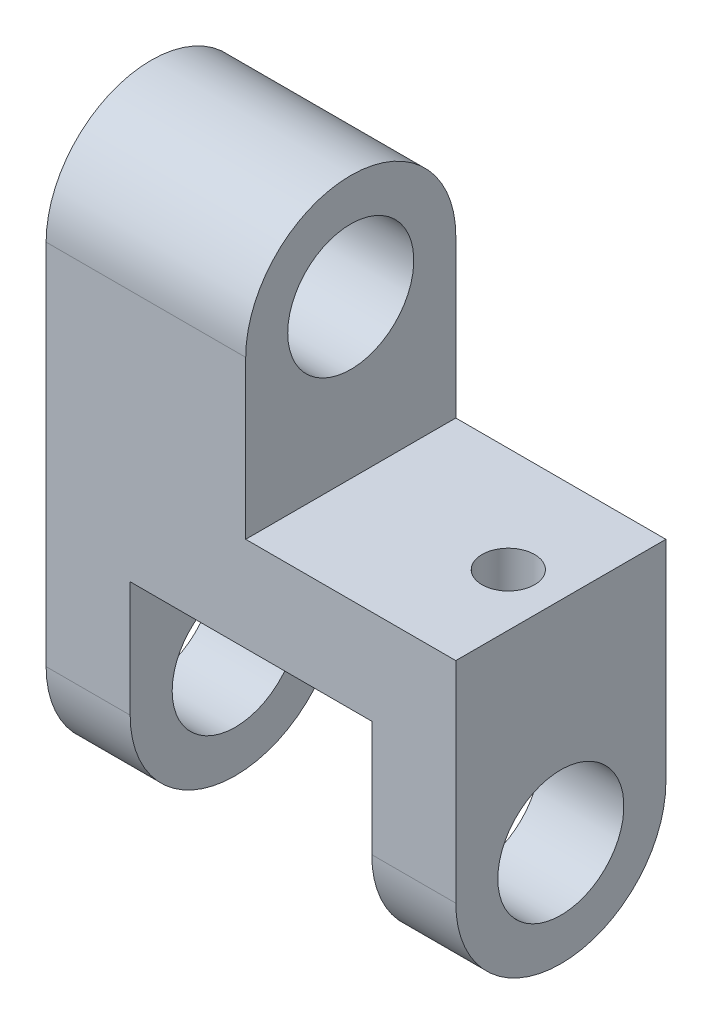
from build123d import *

# Parameters (mm, degrees)
SKETCH_1_R               = 6
EXTRUDE_1_DEPTH          = 39
CUT_EXTRUDE_1_DEPTH      = 49.757050772
CUT_EXTRUDE_1_DEPTH_BACK = 49.757050772
SKETCH_2_W               = 23
SKETCH_2_H               = 34.092407746
CUT_EXTRUDE_2_DEPTH      = 49.757050772
CUT_EXTRUDE_2_DEPTH_BACK = 49.757050772
SKETCH_3_W               = 43.713213687
SKETCH_3_H               = 32.597275916
SKETCH_4_R               = 2.5
CUT_EXTRUDE_3_DEPTH      = 12


with BuildPart() as part:
    # Эскиз1 → Бобышка-Вытянуть1 (new body)
    with BuildSketch(Plane(origin=(0, 0, 0), x_dir=(0, 0, -1), z_dir=(1, 0, 0))):
        with BuildLine():
            Line((10, 17.5), (10, -17.5))
            ThreePointArc((10, -17.5), (0, -27.5), (-10, -17.5))
            Line((-10, -17.5), (-10, 17.5))
            ThreePointArc((-10, 17.5), (0, 27.5), (10, 17.5))
        make_face()
        with Locations((0, 17.5)):
            Circle(SKETCH_1_R, mode=Mode.SUBTRACT)
        with Locations(Location((0, -17.5, 0), (0, 0, 180))):
            Circle(SKETCH_1_R, mode=Mode.SUBTRACT)
    extrude(amount=EXTRUDE_1_DEPTH)

    # Эскиз2 → Вырез-Вытянуть1 (cut, two sides: drawn at the far end of the back side and taken through both)
    with BuildSketch(Plane.XY.offset(-CUT_EXTRUDE_1_DEPTH_BACK)):
        with Locations((19.5, -23.546203873)):
            Rectangle(SKETCH_2_W, SKETCH_2_H)
    extrude(amount=CUT_EXTRUDE_1_DEPTH + CUT_EXTRUDE_1_DEPTH_BACK, mode=Mode.SUBTRACT)

    # Эскиз3 → Вырез-Вытянуть2 (cut, two sides: drawn at the far end of the back side and taken through both)
    with BuildSketch(Plane.XY.offset(-CUT_EXTRUDE_2_DEPTH_BACK)):
        with Locations((40.856606844, 18.798637958)):
            Rectangle(SKETCH_3_W, SKETCH_3_H)
    extrude(amount=CUT_EXTRUDE_2_DEPTH + CUT_EXTRUDE_2_DEPTH_BACK, mode=Mode.SUBTRACT)

    # Эскиз4 → Вырез-Вытянуть3 (cut)
    with BuildSketch(Plane(origin=(0, 2.5, 0), x_dir=(1, 0, 0), z_dir=(0, 1, 0))):
        with Locations(Location((34, 0, 0), (0, 0, 270))):
            Circle(SKETCH_4_R)
    extrude(amount=-CUT_EXTRUDE_3_DEPTH, mode=Mode.SUBTRACT)


solid = part.part
